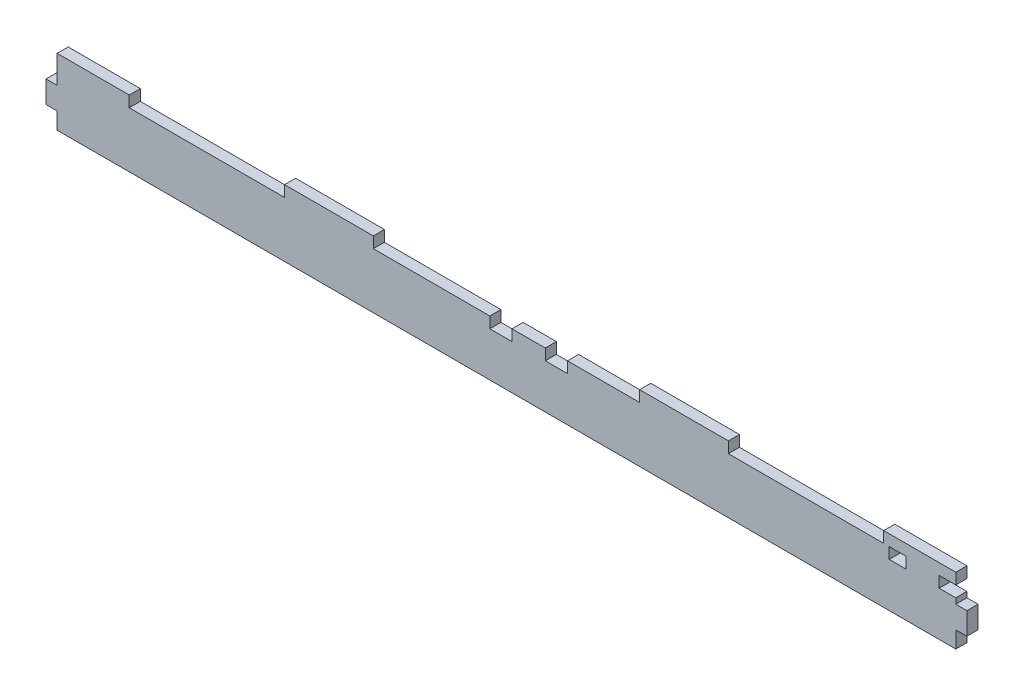
from build123d import *

# Parameters (mm, degrees)
SKETCH1_W           = 7.5
SKETCH1_H           = 5
BOSS_EXTRUDE1_DEPTH = 5


with BuildPart() as part:
    # Sketch1 → Boss-Extrude1 (new body)
    with BuildSketch(Plane.XY):
        Polygon((480, 177.5), (485, 177.5), (485, 187.5), (480, 187.5), (480, 190), (472.5, 190), (472.5, 195), (480, 195), (480, 200), (447.5, 200), (447.5, 195), (377.5, 195), (377.5, 200), (337.5, 200), (337.5, 195), (305, 195), (305, 190), (295, 190), (295, 195), (280, 195), (280, 190), (270, 190), (270, 195), (217.5, 195), (217.5, 200), (177.5, 200), (177.5, 195), (107.5, 195), (107.5, 200), (75, 200), (75, 195), (75, 187.5), (70, 187.5), (70, 177.5), (75, 177.5), (75, 170), (480, 170), align=None)
        with Locations((453.75, 192.5)):
            Rectangle(SKETCH1_W, SKETCH1_H, mode=Mode.SUBTRACT)
    extrude(amount=BOSS_EXTRUDE1_DEPTH)


solid = part.part
